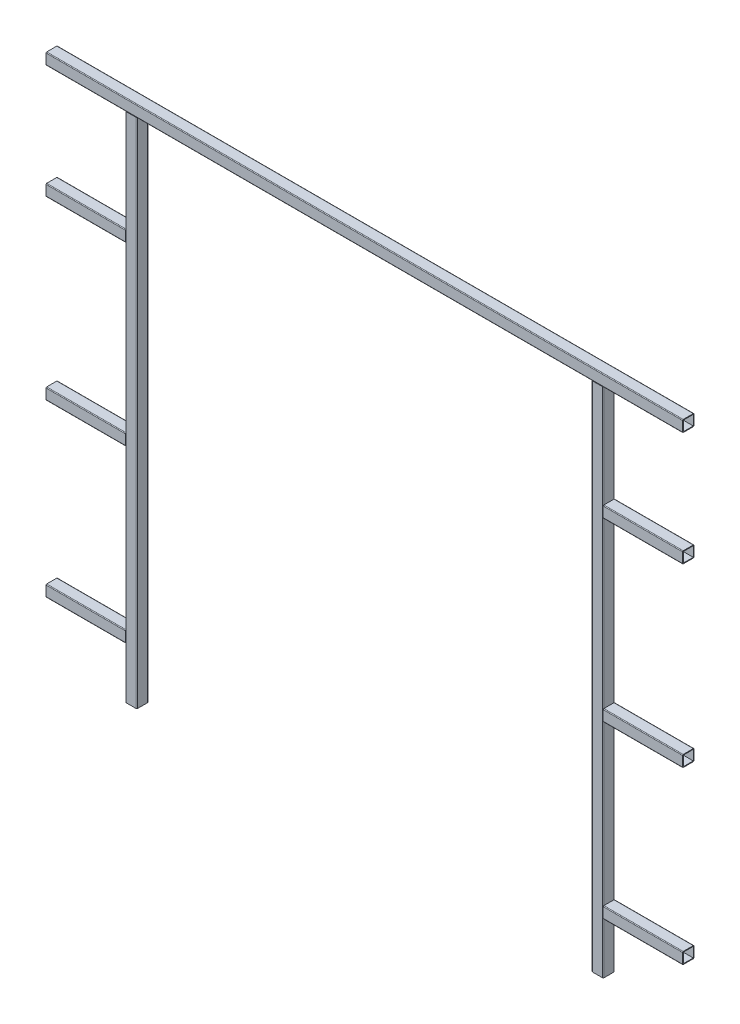
from build123d import *

# Parameters (mm, degrees)
F_8639_82_100_X_100_X_6_0_1_DEPTH   = 5595
F_8639_82_100_X_100_X_6_0_1_2_DEPTH = 748.5
F_8639_82_100_X_100_X_6_0_1_3_DEPTH = 748.5
F_8639_82_100_X_100_X_6_0_1_4_DEPTH = 748.5
F_8639_82_100_X_100_X_6_0_1_5_DEPTH = 748.5
F_8639_82_100_X_100_X_6_0_1_6_DEPTH = 748.5
F_8639_82_100_X_100_X_6_0_1_7_DEPTH = 748.5
F_8639_82_100_X_100_X_6_0_1_8_DEPTH = 4551
F_8639_82_100_X_100_X_6_0_1_9_DEPTH = 4551


with BuildPart() as part:
    # Sketch1 → Квадратная труба гост 8639-82 100 X 100 X 6.0(1) (new body)
    with BuildSketch(Plane.YZ):
        with BuildLine():
            Line((-43.999, -50), (43.999, -50))
            ThreePointArc((43.999, -50), (48.242347794, -48.242347794), (50, -43.999))
            Line((50, -43.999), (50, 43.999))
            ThreePointArc((50, 43.999), (48.242347794, 48.242347794), (43.999, 50))
            Line((43.999, 50), (-43.999, 50))
            ThreePointArc((-43.999, 50), (-48.242347794, 48.242347794), (-50, 43.999))
            Line((-50, 43.999), (-50, -43.999))
            ThreePointArc((-50, -43.999), (-48.242347794, -48.242347794), (-43.999, -50))
        make_face()
        with BuildLine():
            Line((-43.999, -44), (43.999, -44))
            ThreePointArc((43.999, -44), (43.999707107, -43.999707107), (44, -43.999))
            Line((44, -43.999), (44, 43.999))
            ThreePointArc((44, 43.999), (43.999707107, 43.999707107), (43.999, 44))
            Line((43.999, 44), (-43.999, 44))
            ThreePointArc((-43.999, 44), (-43.999707107, 43.999707107), (-44, 43.999))
            Line((-44, 43.999), (-44, -43.999))
            ThreePointArc((-44, -43.999), (-43.999707107, -43.999707107), (-43.999, -44))
        make_face(mode=Mode.SUBTRACT)
    extrude(amount=F_8639_82_100_X_100_X_6_0_1_DEPTH)


with BuildPart() as body_2:
    # Sketch1 on segment 2 (carried to segment 2) → 8639-82 100 X 100 X 6.0_1 2 (new body)
    with BuildSketch(Plane(origin=(0, -1000, 0), x_dir=(0, 1, 0), z_dir=(1, 0, 0))):
        with BuildLine():
            Line((-43.999, -50), (43.999, -50))
            ThreePointArc((43.999, -50), (48.242347794, -48.242347794), (50, -43.999))
            Line((50, -43.999), (50, 43.999))
            ThreePointArc((50, 43.999), (48.242347794, 48.242347794), (43.999, 50))
            Line((43.999, 50), (-43.999, 50))
            ThreePointArc((-43.999, 50), (-48.242347794, 48.242347794), (-50, 43.999))
            Line((-50, 43.999), (-50, -43.999))
            ThreePointArc((-50, -43.999), (-48.242347794, -48.242347794), (-43.999, -50))
        make_face()
        with BuildLine():
            Line((-43.999, -44), (43.999, -44))
            ThreePointArc((43.999, -44), (43.999707107, -43.999707107), (44, -43.999))
            Line((44, -43.999), (44, 43.999))
            ThreePointArc((44, 43.999), (43.999707107, 43.999707107), (43.999, 44))
            Line((43.999, 44), (-43.999, 44))
            ThreePointArc((-43.999, 44), (-43.999707107, 43.999707107), (-44, 43.999))
            Line((-44, 43.999), (-44, -43.999))
            ThreePointArc((-44, -43.999), (-43.999707107, -43.999707107), (-43.999, -44))
        make_face(mode=Mode.SUBTRACT)
    extrude(amount=F_8639_82_100_X_100_X_6_0_1_2_DEPTH)

    # 8639-82 100 X 100 X 6.0_1 2 end butt 1
    split(bisect_by=Plane(origin=(697.5, -1000, 0), x_dir=(0, -1, 0), z_dir=(-1, 0, 0)), keep=Keep.TOP)


with BuildPart() as body_3:
    # Sketch1 on segment 3 (carried to segment 3) → 8639-82 100 X 100 X 6.0_1 3 (new body)
    with BuildSketch(Plane(origin=(0, -4050, 0), x_dir=(0, 1, 0), z_dir=(1, 0, 0))):
        with BuildLine():
            Line((-43.999, -50), (43.999, -50))
            ThreePointArc((43.999, -50), (48.242347794, -48.242347794), (50, -43.999))
            Line((50, -43.999), (50, 43.999))
            ThreePointArc((50, 43.999), (48.242347794, 48.242347794), (43.999, 50))
            Line((43.999, 50), (-43.999, 50))
            ThreePointArc((-43.999, 50), (-48.242347794, 48.242347794), (-50, 43.999))
            Line((-50, 43.999), (-50, -43.999))
            ThreePointArc((-50, -43.999), (-48.242347794, -48.242347794), (-43.999, -50))
        make_face()
        with BuildLine():
            Line((-43.999, -44), (43.999, -44))
            ThreePointArc((43.999, -44), (43.999707107, -43.999707107), (44, -43.999))
            Line((44, -43.999), (44, 43.999))
            ThreePointArc((44, 43.999), (43.999707107, 43.999707107), (43.999, 44))
            Line((43.999, 44), (-43.999, 44))
            ThreePointArc((-43.999, 44), (-43.999707107, 43.999707107), (-44, 43.999))
            Line((-44, 43.999), (-44, -43.999))
            ThreePointArc((-44, -43.999), (-43.999707107, -43.999707107), (-43.999, -44))
        make_face(mode=Mode.SUBTRACT)
    extrude(amount=F_8639_82_100_X_100_X_6_0_1_3_DEPTH)

    # 8639-82 100 X 100 X 6.0_1 3 end butt 1
    split(bisect_by=Plane(origin=(697.5, -4050, 0), x_dir=(0, -1, 0), z_dir=(-1, 0, 0)), keep=Keep.TOP)


with BuildPart() as body_4:
    # Sketch1 on segment 4 (carried to segment 4) → 8639-82 100 X 100 X 6.0_1 4 (new body)
    with BuildSketch(Plane(origin=(4846.5, -4050, 0), x_dir=(0, 1, 0), z_dir=(1, 0, 0))):
        with BuildLine():
            Line((-43.999, -50), (43.999, -50))
            ThreePointArc((43.999, -50), (48.242347794, -48.242347794), (50, -43.999))
            Line((50, -43.999), (50, 43.999))
            ThreePointArc((50, 43.999), (48.242347794, 48.242347794), (43.999, 50))
            Line((43.999, 50), (-43.999, 50))
            ThreePointArc((-43.999, 50), (-48.242347794, 48.242347794), (-50, 43.999))
            Line((-50, 43.999), (-50, -43.999))
            ThreePointArc((-50, -43.999), (-48.242347794, -48.242347794), (-43.999, -50))
        make_face()
        with BuildLine():
            Line((-43.999, -44), (43.999, -44))
            ThreePointArc((43.999, -44), (43.999707107, -43.999707107), (44, -43.999))
            Line((44, -43.999), (44, 43.999))
            ThreePointArc((44, 43.999), (43.999707107, 43.999707107), (43.999, 44))
            Line((43.999, 44), (-43.999, 44))
            ThreePointArc((-43.999, 44), (-43.999707107, 43.999707107), (-44, 43.999))
            Line((-44, 43.999), (-44, -43.999))
            ThreePointArc((-44, -43.999), (-43.999707107, -43.999707107), (-43.999, -44))
        make_face(mode=Mode.SUBTRACT)
    extrude(amount=F_8639_82_100_X_100_X_6_0_1_4_DEPTH)

    # 8639-82 100 X 100 X 6.0_1 4 end butt 1
    split(bisect_by=Plane(origin=(4897.5, -4050, 0), x_dir=(0, 1, 0), z_dir=(1, 0, 0)), keep=Keep.TOP)


with BuildPart() as body_5:
    # Sketch1 on segment 5 (carried to segment 5) → 8639-82 100 X 100 X 6.0_1 5 (new body)
    with BuildSketch(Plane(origin=(4846.5, -1000, 0), x_dir=(0, 1, 0), z_dir=(1, 0, 0))):
        with BuildLine():
            Line((-43.999, -50), (43.999, -50))
            ThreePointArc((43.999, -50), (48.242347794, -48.242347794), (50, -43.999))
            Line((50, -43.999), (50, 43.999))
            ThreePointArc((50, 43.999), (48.242347794, 48.242347794), (43.999, 50))
            Line((43.999, 50), (-43.999, 50))
            ThreePointArc((-43.999, 50), (-48.242347794, 48.242347794), (-50, 43.999))
            Line((-50, 43.999), (-50, -43.999))
            ThreePointArc((-50, -43.999), (-48.242347794, -48.242347794), (-43.999, -50))
        make_face()
        with BuildLine():
            Line((-43.999, -44), (43.999, -44))
            ThreePointArc((43.999, -44), (43.999707107, -43.999707107), (44, -43.999))
            Line((44, -43.999), (44, 43.999))
            ThreePointArc((44, 43.999), (43.999707107, 43.999707107), (43.999, 44))
            Line((43.999, 44), (-43.999, 44))
            ThreePointArc((-43.999, 44), (-43.999707107, 43.999707107), (-44, 43.999))
            Line((-44, 43.999), (-44, -43.999))
            ThreePointArc((-44, -43.999), (-43.999707107, -43.999707107), (-43.999, -44))
        make_face(mode=Mode.SUBTRACT)
    extrude(amount=F_8639_82_100_X_100_X_6_0_1_5_DEPTH)

    # 8639-82 100 X 100 X 6.0_1 5 end butt 1
    split(bisect_by=Plane(origin=(4897.5, -1000, 0), x_dir=(0, 1, 0), z_dir=(1, 0, 0)), keep=Keep.TOP)


with BuildPart() as body_6:
    # Sketch1 on segment 6 (carried to segment 6) → 8639-82 100 X 100 X 6.0_1 6 (new body)
    with BuildSketch(Plane(origin=(0, -2550, 0), x_dir=(0, 1, 0), z_dir=(1, 0, 0))):
        with BuildLine():
            Line((-43.999, -50), (43.999, -50))
            ThreePointArc((43.999, -50), (48.242347794, -48.242347794), (50, -43.999))
            Line((50, -43.999), (50, 43.999))
            ThreePointArc((50, 43.999), (48.242347794, 48.242347794), (43.999, 50))
            Line((43.999, 50), (-43.999, 50))
            ThreePointArc((-43.999, 50), (-48.242347794, 48.242347794), (-50, 43.999))
            Line((-50, 43.999), (-50, -43.999))
            ThreePointArc((-50, -43.999), (-48.242347794, -48.242347794), (-43.999, -50))
        make_face()
        with BuildLine():
            Line((-43.999, -44), (43.999, -44))
            ThreePointArc((43.999, -44), (43.999707107, -43.999707107), (44, -43.999))
            Line((44, -43.999), (44, 43.999))
            ThreePointArc((44, 43.999), (43.999707107, 43.999707107), (43.999, 44))
            Line((43.999, 44), (-43.999, 44))
            ThreePointArc((-43.999, 44), (-43.999707107, 43.999707107), (-44, 43.999))
            Line((-44, 43.999), (-44, -43.999))
            ThreePointArc((-44, -43.999), (-43.999707107, -43.999707107), (-43.999, -44))
        make_face(mode=Mode.SUBTRACT)
    extrude(amount=F_8639_82_100_X_100_X_6_0_1_6_DEPTH)

    # 8639-82 100 X 100 X 6.0_1 6 end butt 1
    split(bisect_by=Plane(origin=(697.5, -2550, 0), x_dir=(0, -1, 0), z_dir=(-1, 0, 0)), keep=Keep.TOP)


with BuildPart() as body_7:
    # Sketch1 on segment 7 (carried to segment 7) → 8639-82 100 X 100 X 6.0_1 7 (new body)
    with BuildSketch(Plane(origin=(4846.5, -2550, 0), x_dir=(0, 1, 0), z_dir=(1, 0, 0))):
        with BuildLine():
            Line((-43.999, -50), (43.999, -50))
            ThreePointArc((43.999, -50), (48.242347794, -48.242347794), (50, -43.999))
            Line((50, -43.999), (50, 43.999))
            ThreePointArc((50, 43.999), (48.242347794, 48.242347794), (43.999, 50))
            Line((43.999, 50), (-43.999, 50))
            ThreePointArc((-43.999, 50), (-48.242347794, 48.242347794), (-50, 43.999))
            Line((-50, 43.999), (-50, -43.999))
            ThreePointArc((-50, -43.999), (-48.242347794, -48.242347794), (-43.999, -50))
        make_face()
        with BuildLine():
            Line((-43.999, -44), (43.999, -44))
            ThreePointArc((43.999, -44), (43.999707107, -43.999707107), (44, -43.999))
            Line((44, -43.999), (44, 43.999))
            ThreePointArc((44, 43.999), (43.999707107, 43.999707107), (43.999, 44))
            Line((43.999, 44), (-43.999, 44))
            ThreePointArc((-43.999, 44), (-43.999707107, 43.999707107), (-44, 43.999))
            Line((-44, 43.999), (-44, -43.999))
            ThreePointArc((-44, -43.999), (-43.999707107, -43.999707107), (-43.999, -44))
        make_face(mode=Mode.SUBTRACT)
    extrude(amount=F_8639_82_100_X_100_X_6_0_1_7_DEPTH)

    # 8639-82 100 X 100 X 6.0_1 7 end butt 1
    split(bisect_by=Plane(origin=(4897.5, -2550, 0), x_dir=(0, 1, 0), z_dir=(1, 0, 0)), keep=Keep.TOP)


with BuildPart() as body_8:
    # Sketch1 on segment 8 (carried to segment 8) → 8639-82 100 X 100 X 6.0_1 8 (new body)
    with BuildSketch(Plane(origin=(747.5, 1, 0), x_dir=(1, 0, 0), z_dir=(0, -1, 0))):
        with BuildLine():
            Line((-43.999, -50), (43.999, -50))
            ThreePointArc((43.999, -50), (48.242347794, -48.242347794), (50, -43.999))
            Line((50, -43.999), (50, 43.999))
            ThreePointArc((50, 43.999), (48.242347794, 48.242347794), (43.999, 50))
            Line((43.999, 50), (-43.999, 50))
            ThreePointArc((-43.999, 50), (-48.242347794, 48.242347794), (-50, 43.999))
            Line((-50, 43.999), (-50, -43.999))
            ThreePointArc((-50, -43.999), (-48.242347794, -48.242347794), (-43.999, -50))
        make_face()
        with BuildLine():
            Line((-43.999, -44), (43.999, -44))
            ThreePointArc((43.999, -44), (43.999707107, -43.999707107), (44, -43.999))
            Line((44, -43.999), (44, 43.999))
            ThreePointArc((44, 43.999), (43.999707107, 43.999707107), (43.999, 44))
            Line((43.999, 44), (-43.999, 44))
            ThreePointArc((-43.999, 44), (-43.999707107, 43.999707107), (-44, 43.999))
            Line((-44, 43.999), (-44, -43.999))
            ThreePointArc((-44, -43.999), (-43.999707107, -43.999707107), (-43.999, -44))
        make_face(mode=Mode.SUBTRACT)
    extrude(amount=F_8639_82_100_X_100_X_6_0_1_8_DEPTH)

    # 8639-82 100 X 100 X 6.0_1 8 end butt 1
    split(bisect_by=Plane(origin=(747.5, -50, 0), x_dir=(1, 0, 0), z_dir=(0, -1, 0)), keep=Keep.TOP)


with BuildPart() as body_9:
    # Sketch1 on segment 9 (carried to segment 9) → 8639-82 100 X 100 X 6.0_1 9 (new body)
    with BuildSketch(Plane(origin=(4847.5, 1, 0), x_dir=(1, 0, 0), z_dir=(0, -1, 0))):
        with BuildLine():
            Line((-43.999, -50), (43.999, -50))
            ThreePointArc((43.999, -50), (48.242347794, -48.242347794), (50, -43.999))
            Line((50, -43.999), (50, 43.999))
            ThreePointArc((50, 43.999), (48.242347794, 48.242347794), (43.999, 50))
            Line((43.999, 50), (-43.999, 50))
            ThreePointArc((-43.999, 50), (-48.242347794, 48.242347794), (-50, 43.999))
            Line((-50, 43.999), (-50, -43.999))
            ThreePointArc((-50, -43.999), (-48.242347794, -48.242347794), (-43.999, -50))
        make_face()
        with BuildLine():
            Line((-43.999, -44), (43.999, -44))
            ThreePointArc((43.999, -44), (43.999707107, -43.999707107), (44, -43.999))
            Line((44, -43.999), (44, 43.999))
            ThreePointArc((44, 43.999), (43.999707107, 43.999707107), (43.999, 44))
            Line((43.999, 44), (-43.999, 44))
            ThreePointArc((-43.999, 44), (-43.999707107, 43.999707107), (-44, 43.999))
            Line((-44, 43.999), (-44, -43.999))
            ThreePointArc((-44, -43.999), (-43.999707107, -43.999707107), (-43.999, -44))
        make_face(mode=Mode.SUBTRACT)
    extrude(amount=F_8639_82_100_X_100_X_6_0_1_9_DEPTH)

    # 8639-82 100 X 100 X 6.0_1 9 end butt 1
    split(bisect_by=Plane(origin=(4847.5, -50, 0), x_dir=(1, 0, 0), z_dir=(0, -1, 0)), keep=Keep.TOP)


solid = Compound([part.part, body_2.part, body_3.part, body_4.part, body_5.part, body_6.part, body_7.part, body_8.part, body_9.part])
